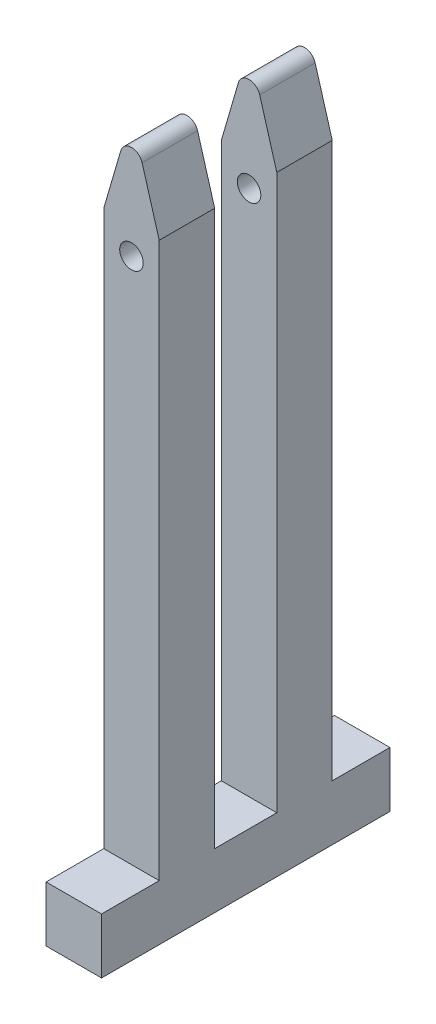
from build123d import *

# Parameters (mm, degrees)
SKETCH1_W             = 25
SKETCH1_H             = 25
BOSS_EXTRUDE1_DEPTH   = 250
BOSS_EXTRUDE1_2_DEPTH = 250
SKETCH2_R             = 5.3
CUT_EXTRUDE1_DEPTH    = 263.183618863
BOSS_EXTRUDE2_REACH   = 264.184
SKETCH4_W             = 25
SKETCH4_H             = 28
CUT_EXTRUDE2_DEPTH    = 254.332291665
BOSS_EXTRUDE3_START   = -53
SKETCH5_R             = 5
BOSS_EXTRUDE3_DEPTH   = 28
SKETCH6_W             = 25
SKETCH6_H             = 130
BOSS_EXTRUDE4_DEPTH   = 25
SKETCH7_W             = 25
SKETCH7_H             = 28
CUT_EXTRUDE3_DEPTH    = 323


with BuildPart() as part:
    # Sketch1 → Boss-Extrude1 (new body)
    with BuildSketch(Plane(origin=(0, 0, 0), x_dir=(1, 0, 0), z_dir=(0, 1, 0))):
        with Locations((0, 26.5)):
            Rectangle(SKETCH1_W, SKETCH1_H)
    extrude(amount=BOSS_EXTRUDE1_DEPTH)


with BuildPart() as body_2:
    # Sketch1 → Boss-Extrude1 2 (new body)
    with BuildSketch(Plane(origin=(0, 0, 0), x_dir=(1, 0, 0), z_dir=(0, 1, 0))):
        with Locations((0, -26.5)):
            Rectangle(SKETCH1_W, SKETCH1_H)
    extrude(amount=BOSS_EXTRUDE1_2_DEPTH)


with BuildPart() as cut_extrude1_tool:
    # Sketch2 → Cut-Extrude1 (new, through all)
    with BuildSketch(Plane.XY.offset(39)):
        with Locations((0, 237.5)):
            Circle(SKETCH2_R)
    extrude(amount=-CUT_EXTRUDE1_DEPTH)


with BuildPart() as part_1:
    add(part.part)

    # Cut-Extrude1: cut by cut_extrude1_tool
    add(cut_extrude1_tool.part, mode=Mode.SUBTRACT)

    # Boss-Extrude2: up to this face of the body (flat: up to its plane)
    boss_extrude2_end = Plane(part_1.part.faces().sort_by_distance((0, 123.388798443, -39))[0])
    # Sketch3 → Boss-Extrude2 (add, up to the picked face)
    with BuildSketch(Plane.XY.offset(39), mode=Mode.PRIVATE) as boss_extrude2_sk1:
        with BuildLine():
            Line((-12.5, 250), (-4.8, 276.4))
            ThreePointArc((-4.8, 276.4), (0, 280), (4.8, 276.4))
            Line((4.8, 276.4), (12.5, 250))
            Line((12.5, 250), (-12.5, 250))
        make_face()
    boss_extrude2_tool1 = split(extrude(boss_extrude2_sk1.sketch, amount=-BOSS_EXTRUDE2_REACH, mode=Mode.PRIVATE), bisect_by=boss_extrude2_end, keep=Keep.BOTH, mode=Mode.PRIVATE)


with BuildPart() as body_2_1:
    add(body_2.part)

    # Cut-Extrude1: cut by cut_extrude1_tool
    add(cut_extrude1_tool.part, mode=Mode.SUBTRACT)


with BuildPart() as part_2:
    add(part_1.part)

    add(body_2_1.part)  # Boss-Extrude2 merges body 2
    add(boss_extrude2_tool1.solids().sort_by(Axis((0, 262.12086, 39), (0, 0, -1)))[0])

    # Sketch4 → Cut-Extrude2 (cut, through all)
    with BuildSketch(Plane.XZ.offset(-250)):
        Rectangle(SKETCH4_W, SKETCH4_H)
    extrude(amount=-CUT_EXTRUDE2_DEPTH, mode=Mode.SUBTRACT)


with BuildPart() as cut_extrude2_piece_1:
    # of the separate pieces the step leaves, piece 1, a body of its own (cut_extrude2_pieces)
    add(part_2.part.solids().sort_by_distance((4.8, 276.4, 39))[0])



with BuildPart() as cut_extrude2_piece_2:
    # of the separate pieces the step leaves, piece 2, a body of its own (cut_extrude2_pieces)
    add(part_2.part.solids().sort_by_distance((12.5, 250, -14))[0])


with BuildPart() as cut_extrude2_piece_1_1:
    add(cut_extrude2_piece_1.part)

    add(cut_extrude2_piece_2.part)  # Boss-Extrude3 merges Cut-Extrude2 piece 2
    # Sketch5 → Boss-Extrude3 (add)
    with BuildSketch(Plane(origin=(0, 0, -39), x_dir=(-1, 0, 0), z_dir=(0, 0, -1)).offset(BOSS_EXTRUDE3_START)):
        with Locations(Location((0, 275, 0), (0, 0, 163.739795292))):
            Circle(SKETCH5_R)
    extrude(amount=BOSS_EXTRUDE3_DEPTH)

    # Sketch6 → Boss-Extrude4 (add)
    with BuildSketch(Plane.XZ):
        Rectangle(SKETCH6_W, SKETCH6_H)
    extrude(amount=BOSS_EXTRUDE4_DEPTH)

    # Sketch7 → Cut-Extrude3 (cut)
    with BuildSketch(Plane(origin=(0, 0, 0), x_dir=(1, 0, 0), z_dir=(0, 1, 0))):
        Rectangle(SKETCH7_W, SKETCH7_H)
    extrude(amount=CUT_EXTRUDE3_DEPTH, mode=Mode.SUBTRACT)


solid = cut_extrude2_piece_1_1.part
